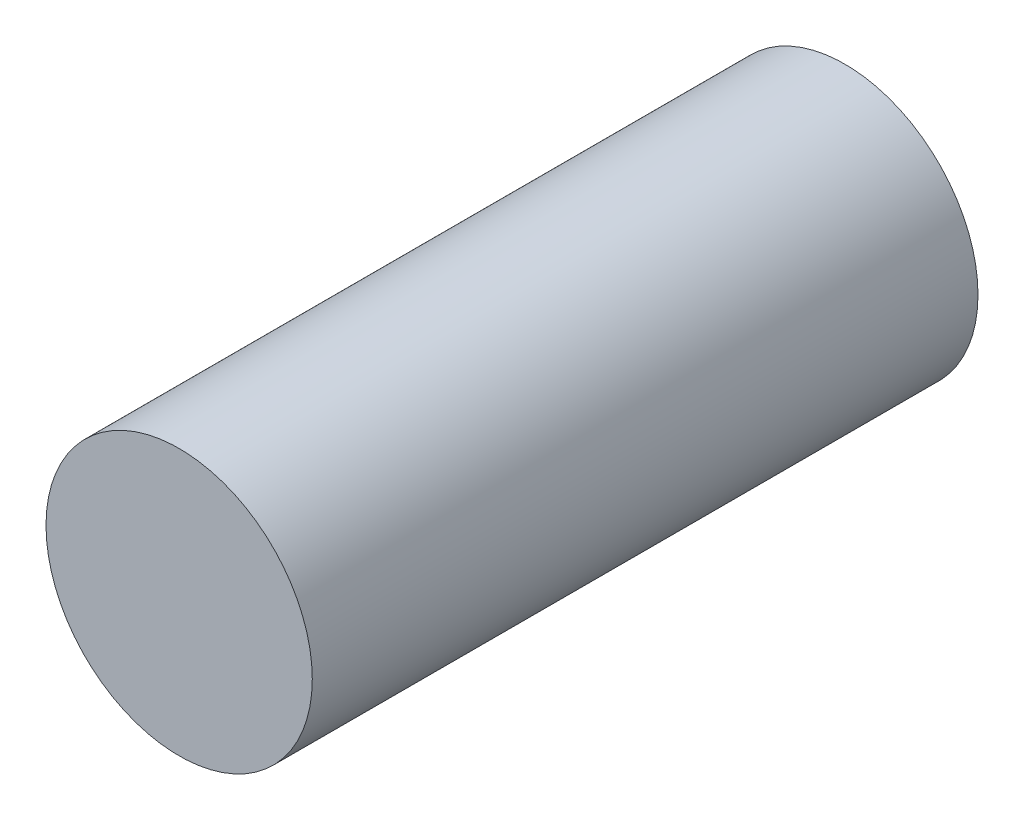
from build123d import *

# Parameters (mm, degrees)
SKETCH1_R           = 3.175
BOSS_EXTRUDE1_DEPTH = 15.875


with BuildPart() as part:
    # Sketch1 → Boss-Extrude1 (new body)
    with BuildSketch(Plane.XY):
        Circle(SKETCH1_R)
    extrude(amount=BOSS_EXTRUDE1_DEPTH)


solid = part.part
